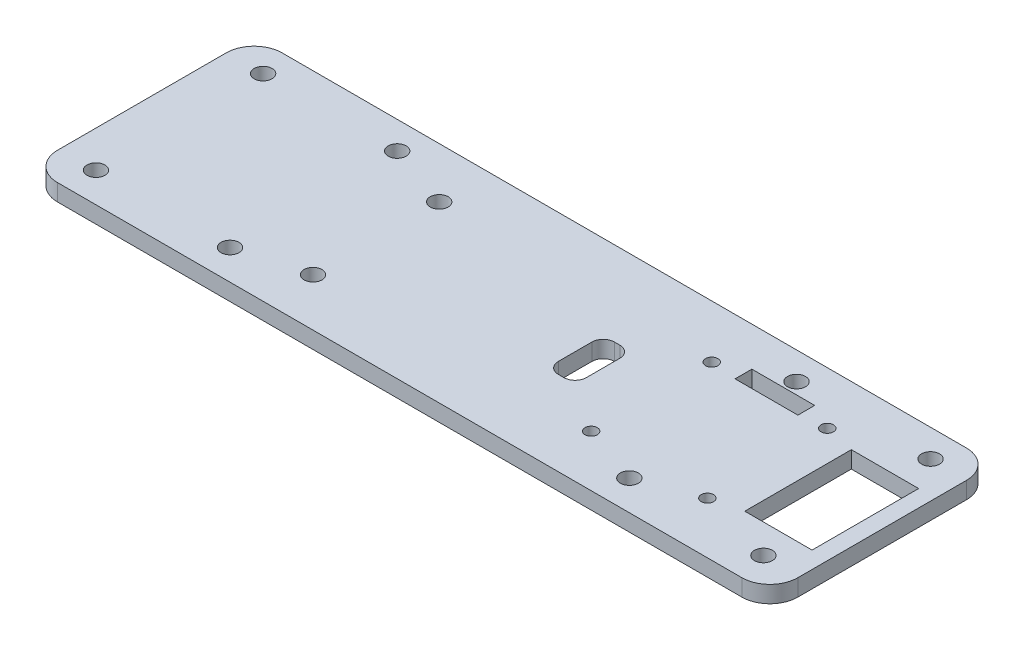
from build123d import *

# Parameters (mm, degrees)
SKETCH_1_W          = 132
SKETCH_1_H          = 40.05
SKETCH_1_R          = 1.6
EXTRUDE_1_DEPTH     = 3
FILLET_1_R          = 5
FILLET_2_R          = 5
SKETCH_4_R          = 1.1
SKETCH_4_W          = 12
SKETCH_4_H          = 19
SKETCH_4_W_2        = 11.2
SKETCH_4_H_2        = 3
CUT_EXTRUDE_1_DEPTH = 10
SKETCH_5_R          = 1.6
SKETCH_5_W          = 5
SKETCH_5_H          = 10
CUT_EXTRUDE_2_DEPTH = 10
FILLET_3_R          = 2


with BuildPart() as part:
    # 草图1 → 凸台-拉伸1 (new body)
    with BuildSketch(Plane(origin=(0, 0, 0), x_dir=(1, 0, 0), z_dir=(0, 1, 0))):
        with Locations((-40.850806452, 4.522983871)):
            Rectangle(SKETCH_1_W, SKETCH_1_H)
        with Locations(Location((18.649193548, 19.647983871, 0), (0, 0, 270))):
            Circle(SKETCH_1_R, mode=Mode.SUBTRACT)
        with Locations(Location((18.649193548, -10.152016129, 0), (0, 0, 270))):
            Circle(SKETCH_1_R, mode=Mode.SUBTRACT)
        with Locations(Location((-5.250806452, 19.647983871, 0), (0, 0, 270))):
            Circle(SKETCH_1_R, mode=Mode.SUBTRACT)
        with Locations(Location((-5.250806452, -10.152016129, 0), (0, 0, 270))):
            Circle(SKETCH_1_R, mode=Mode.SUBTRACT)
        with Locations(Location((-100.350806452, -10.152016129, 0), (0, 0, 90))):
            Circle(SKETCH_1_R, mode=Mode.SUBTRACT)
        with Locations(Location((-76.450806452, -10.152016129, 0), (0, 0, 90))):
            Circle(SKETCH_1_R, mode=Mode.SUBTRACT)
        with Locations(Location((-100.350806452, 19.647983871, 0), (0, 0, 90))):
            Circle(SKETCH_1_R, mode=Mode.SUBTRACT)
        with Locations(Location((-76.450806452, 19.647983871, 0), (0, 0, 90))):
            Circle(SKETCH_1_R, mode=Mode.SUBTRACT)
    extrude(amount=EXTRUDE_1_DEPTH)

    # 圆角1
    fillet_1_edges = [part.edges().sort_by_distance(p)[0] for p in [
        (25.149193548, 1.5, -24.547983871),
    ]]
    fillet(fillet_1_edges, radius=FILLET_1_R)

    # 圆角2
    fillet_2_edges = [part.edges().sort_by_distance(p)[0] for p in [
        (25.149193548, 1.5, 15.502016129),
        (-106.850806452, 1.5, 15.502016129),
        (-106.850806452, 1.5, -24.547983871),
    ]]
    fillet(fillet_2_edges, radius=FILLET_2_R)

    # 草图4 → 切除-拉伸1 (cut)
    with BuildSketch(Plane(origin=(0, 3, 0), x_dir=(1, 0, 0), z_dir=(0, 1, 0))):
        with Locations(Location((4.70662119, 15.172983871, 0), (0, 0, 270))):
            Circle(SKETCH_4_R)
        with Locations(Location((4.799193548, -6.297016129, 0), (0, 0, 270))):
            Circle(SKETCH_4_R)
        with Locations(Location((-15.810806452, 15.092983871, 0), (0, 0, 270))):
            Circle(SKETCH_4_R)
        with Locations(Location((-15.900806452, -6.317016129, 0), (0, 0, 270))):
            Circle(SKETCH_4_R)
        with Locations((16.149193548, 4.522983871)):
            Rectangle(SKETCH_4_W, SKETCH_4_H)
        with Locations((-5.550806452, 16.092983871)):
            Rectangle(SKETCH_4_W_2, SKETCH_4_H_2)
    extrude(amount=-CUT_EXTRUDE_1_DEPTH, mode=Mode.SUBTRACT)

    # 草图5 → 切除-拉伸2 (cut)
    with BuildSketch(Plane(origin=(0, 3, 0), x_dir=(1, 0, 0), z_dir=(0, 1, 0))):
        with Locations(Location((-64.850806452, 15.547983871, 0), (0, 0, 270))):
            Circle(SKETCH_5_R)
        with Locations(Location((-64.850806452, -6.952016129, 0), (0, 0, 270))):
            Circle(SKETCH_5_R)
        with Locations((-27.100806452, 4.522983871)):
            Rectangle(SKETCH_5_W, SKETCH_5_H)
    extrude(amount=-CUT_EXTRUDE_2_DEPTH, mode=Mode.SUBTRACT)

    # 圆角3
    fillet_3_edges = [part.edges().sort_by_distance(p)[0] for p in [
        (-24.600806452, 1.5, 0.477016129),
        (-29.600806452, 1.5, 0.477016129),
        (-29.600806452, 1.5, -9.522983871),
        (-24.600806452, 1.5, -9.522983871),
    ]]
    fillet(fillet_3_edges, radius=FILLET_3_R)


solid = part.part
